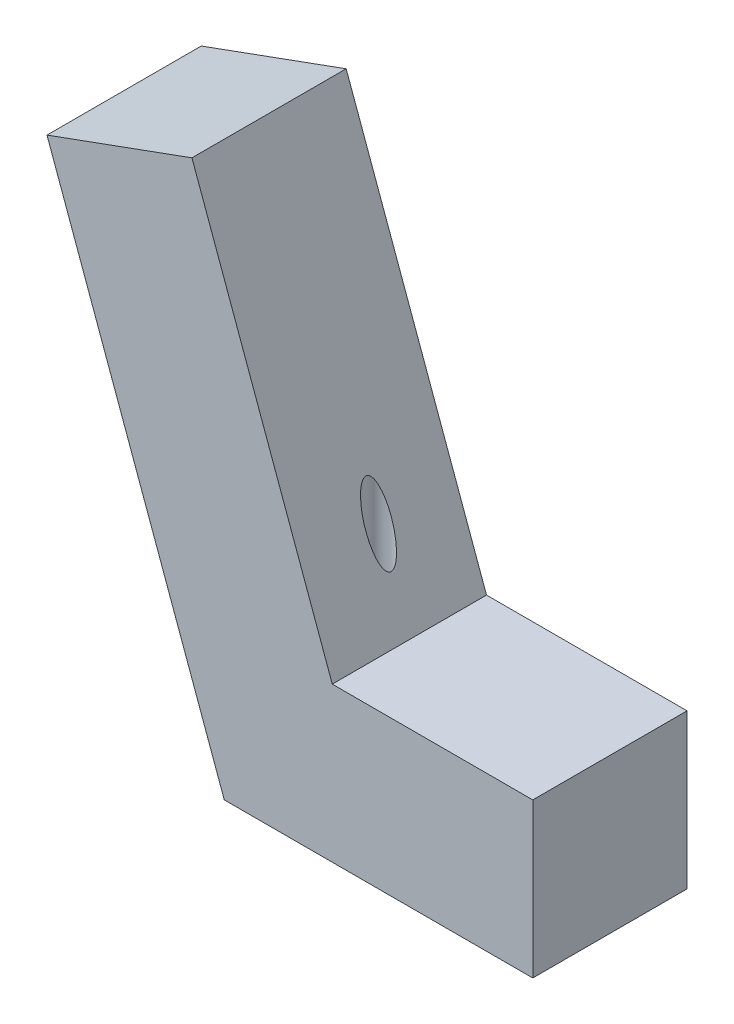
from build123d import *

# Parameters (mm, degrees)
BOSS_EXTRUDE1_DEPTH = 25.4
SKETCH3_R           = 6.35
CUT_EXTRUDE1_DEPTH  = 15.875
SKETCH4_R           = 2.0955
CUT_EXTRUDE2_DEPTH  = 98.893788925


with BuildPart() as part:
    # Sketch1 → Boss-Extrude1 (new body)
    with BuildSketch(Plane.XY):
        Polygon((0, 0), (-19.950187023, 54.81268836), (3.918005545, 63.5), (27.030115421, 0), (60.04484395, 0), (60.04484395, -25.4), (9.24484395, -25.4), align=None)
    extrude(amount=BOSS_EXTRUDE1_DEPTH)

    # Sketch3 → Cut-Extrude1 (cut)
    with BuildSketch(Plane.XZ.offset(25.4)):
        with Locations(Location((21.94484395, 12.7, 0), (0, 0, 270))):
            Circle(SKETCH3_R)
    extrude(amount=-CUT_EXTRUDE1_DEPTH, mode=Mode.SUBTRACT)

    # Sketch4 → Cut-Extrude2 (cut, through all)
    with BuildSketch(Plane.XZ.offset(9.525)):
        with Locations(Location((21.94484395, 12.7, 0), (0, 0, 270))):
            Circle(SKETCH4_R)
    extrude(amount=-CUT_EXTRUDE2_DEPTH, mode=Mode.SUBTRACT)


solid = part.part
